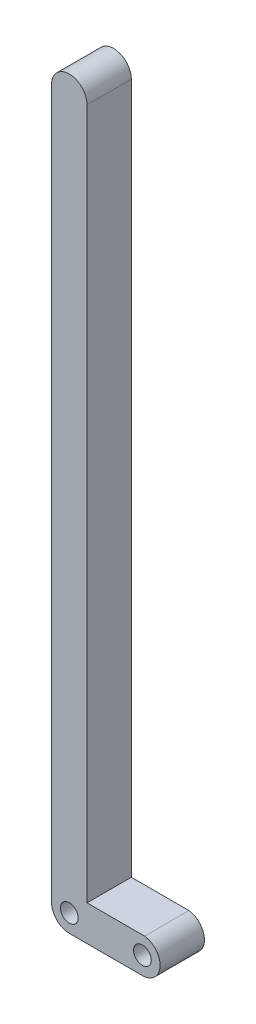
from build123d import *

# Parameters (mm, degrees)
SKETCH_1_R      = 1
EXTRUDE_1_DEPTH = 5


with BuildPart() as part:
    # 草图1 → 凸台-拉伸1 (new body)
    with BuildSketch(Plane.XY):
        with BuildLine():
            Line((-2, 80), (-2, 0))
            ThreePointArc((-2, 0), (-1.414213562, -1.414213562), (0, -2))
            Line((0, -2), (8.25, -2))
            ThreePointArc((8.25, -2), (10.246076458, -0.125214915), (8.499938543, 1.984321225))
            Line((8.499938543, 1.984321225), (1.999938543, 1.984321225))
            Line((1.999938543, 1.984321225), (1.999938543, 79.984321225))
            ThreePointArc((1.999938543, 79.984321225), (0.007839448, 81.999984636), (-2, 80))
        make_face()
        Circle(SKETCH_1_R, mode=Mode.SUBTRACT)
        with Locations((8.25, 0)):
            Circle(SKETCH_1_R, mode=Mode.SUBTRACT)
    extrude(amount=EXTRUDE_1_DEPTH)


solid = part.part
